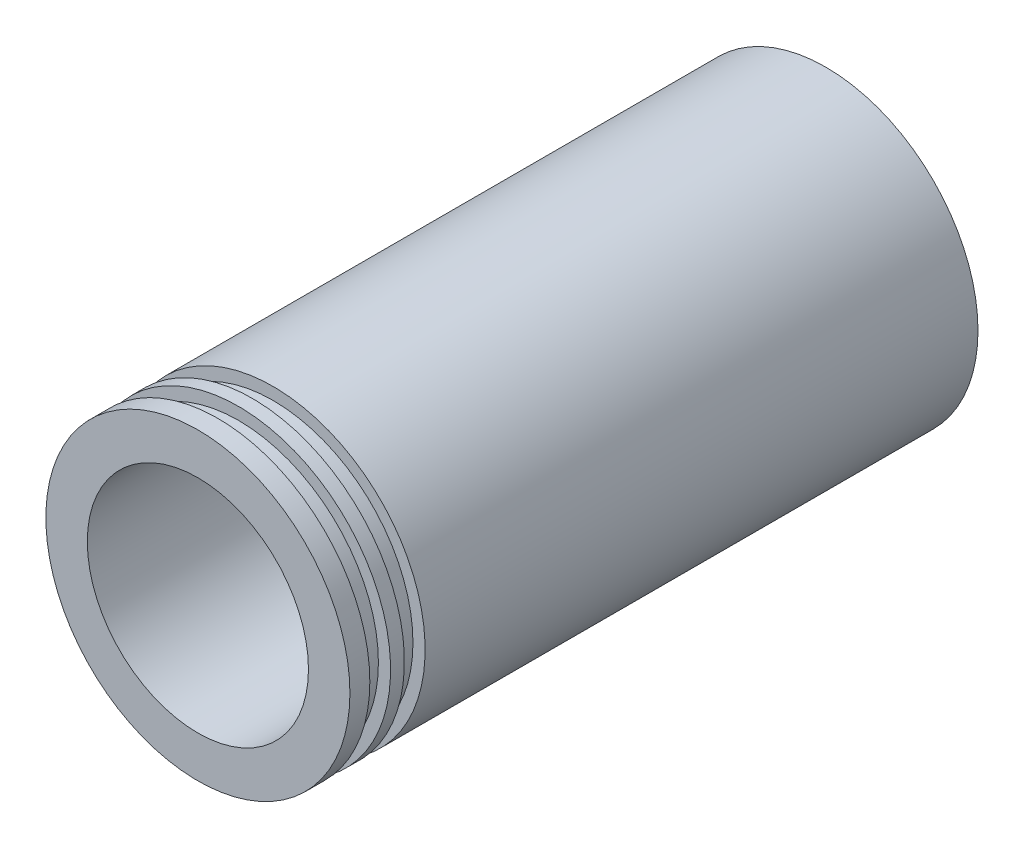
from build123d import *

# Parameters (mm, degrees)
SKETCH1_R           = 34.925
SKETCH1_R_2         = 25.4
BOSS_EXTRUDE1_DEPTH = 144.272
CUT_EXTRUDE1_REACH  = 154.492
SKETCH2_R           = 5.588


with BuildPart() as part:
    # Sketch1 → Boss-Extrude1 (new body)
    with BuildSketch(Plane.XY):
        Circle(SKETCH1_R)
        Circle(SKETCH1_R_2, mode=Mode.SUBTRACT)
    extrude(amount=BOSS_EXTRUDE1_DEPTH)

    # Sketch2 → Cut-Extrude1 (cut, up to next)
    with BuildSketch(Plane(origin=(0, 0, 0), x_dir=(1, 0, 0), z_dir=(0, 1, 0)), mode=Mode.PRIVATE) as cut_extrude1_sk1:
        with Locations((0, -38.1)):
            Circle(SKETCH2_R)
    cut_extrude1_tool1 = extrude(cut_extrude1_sk1.sketch, amount=-CUT_EXTRUDE1_REACH, mode=Mode.PRIVATE) & part.part
    add(cut_extrude1_tool1.solids().sort_by_distance((0, 0, 38.1))[0], mode=Mode.SUBTRACT)

    # Cut-Sweep1: sweep along a path in groove path
    with BuildLine(Plane.XY.offset(131.7625)) as cut_sweep1_path:
        CenterArc((0, 0), 34.925, 0, 360)
    # groove → Cut-Sweep1 (sweep, cut)
    with BuildSketch(Plane(origin=(0, 0, 0), x_dir=(0, 0, -1), z_dir=(1, 0, 0))):
        Polygon((-139.7, 34.925), (-139.7, 32.131), (-134.9375, 32.131), (-134.9375, 34.925), (-131.7625, 34.925), (-131.7625, 32.131), (-127, 32.131), (-127, 34.925), (-127, 38.1), (-139.7, 38.1), align=None)
    sweep(path=cut_sweep1_path.line, mode=Mode.SUBTRACT)


solid = part.part
